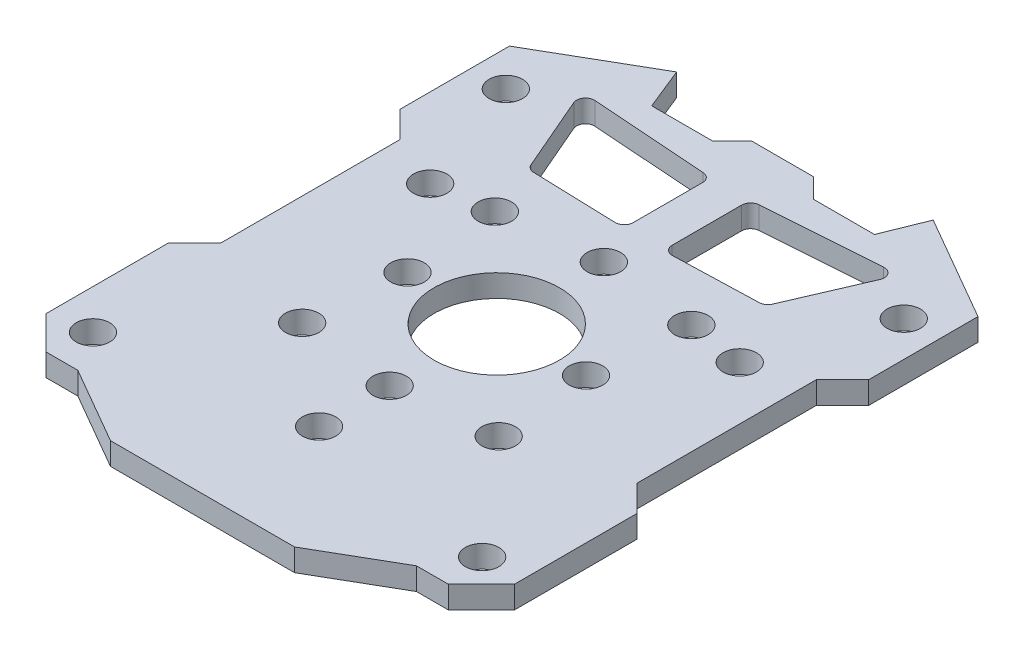
from build123d import *

# Parameters (mm, degrees)
BOSS_EXTRUDE1_DEPTH = 2
SKETCH2_R           = 1.5
SKETCH2_R_2         = 5.625
CUT_EXTRUDE1_DEPTH  = 2
CUT_EXTRUDE2_DEPTH  = 2


with BuildPart() as part:
    # Sketch1 → Boss-Extrude1 (new body)
    with BuildSketch(Plane(origin=(0, 0, 0), x_dir=(1, 0, 0), z_dir=(0, 1, 0))):
        Polygon((2.75, 52), (-2.75, 52), (-4.5, 50.25), (-9.984901653, 50.25), (-11.5, 54), (-21, 48.515172443), (-21, 38.719848481), (-18.65, 36.369848481), (-18.65, 20.319848481), (-21, 17.969848481), (-21, 6.969848481), (-18.030151519, 4), (-15.17820323, 4), (-8.25, 0), (8.25, 0), (15.17820323, 4), (18.030151519, 4), (21, 6.969848481), (21, 17.969848481), (18.65, 20.319848481), (18.65, 36.369848481), (21, 38.719848481), (21, 48.515172443), (11.5, 54), (9.984901653, 50.25), (4.5, 50.25), align=None)
    extrude(amount=BOSS_EXTRUDE1_DEPTH)

    # Sketch2 → Cut-Extrude1 (cut)
    with BuildSketch(Plane(origin=(0, 2, 0), x_dir=(1, 0, 0), z_dir=(0, 1, 0))):
        with Locations(Location((-17.835663744, 45.024259573, 0), (0, 0, 270))):
            Circle(SKETCH2_R)
        with Locations(Location((-17.442435228, 7.623278695, 0), (0, 0, 270))):
            Circle(SKETCH2_R)
        with Locations(Location((0, 10.45, 0), (0, 0, 270))):
            Circle(SKETCH2_R)
        with Locations(Location((0, 16.775, 0), (0, 0, 270))):
            Circle(SKETCH2_R)
        with Locations(Location((0, 26.375, 0), (0, 0, 270))):
            Circle(SKETCH2_R_2)
        with Locations(Location((-8.807408648, 17.738925781, 0), (0, 0, 270))):
            Circle(SKETCH2_R)
        with Locations(Location((-8, 26.375, 0), (0, 0, 270))):
            Circle(SKETCH2_R)
        with Locations(Location((-13.875097841, 34.281056246, 0), (0, 0, 270))):
            Circle(SKETCH2_R)
        with Locations(Location((-8.807408648, 35.011074219, 0), (0, 0, 270))):
            Circle(SKETCH2_R)
        with Locations(Location((0, 35.975, 0), (0, 0, 270))):
            Circle(SKETCH2_R)
    cut_extrude1 = extrude(amount=-CUT_EXTRUDE1_DEPTH, mode=Mode.SUBTRACT)

    # Mirror1: Cut-Extrude1 across plane
    add(cut_extrude1.mirror(Plane(origin=(0, 0, 0), x_dir=(0, 0, 1), z_dir=(1, 0, 0))), mode=Mode.SUBTRACT)

    # Sketch3 → Cut-Extrude2 (cut)
    with BuildSketch(Plane(origin=(0, 2, 0), x_dir=(1, 0, 0), z_dir=(0, 1, 0))):
        with BuildLine():
            Line((-2.493142416, 47.37764179), (-12.937365744, 48.121815295))
            ThreePointArc((-12.937365744, 48.121815295), (-13.646553366, 47.786942566), (-13.728804091, 47.006992794))
            Line((-13.728804091, 47.006992794), (-10.826295121, 40.277760665))
            ThreePointArc((-10.826295121, 40.277760665), (-10.541841622, 39.933254988), (-10.117006121, 39.795006111))
            Line((-10.117006121, 39.795006111), (-2.575291763, 39.556457804))
            ThreePointArc((-2.575291763, 39.556457804), (-1.993328378, 39.781500074), (-1.75, 40.356057908))
            Line((-1.75, 40.356057908), (-1.75, 46.579664839))
            ThreePointArc((-1.75, 46.579664839), (-1.964557404, 47.12487761), (-2.493142416, 47.37764179))
        make_face()
        with BuildLine():
            Line((10.117006121, 39.795006111), (2.575291763, 39.556457804))
            ThreePointArc((2.575291763, 39.556457804), (1.993328378, 39.781500074), (1.75, 40.356057908))
            Line((1.75, 40.356057908), (1.75, 46.579664839))
            ThreePointArc((1.75, 46.579664839), (1.964557404, 47.12487761), (2.493142416, 47.37764179))
            Line((2.493142416, 47.37764179), (12.937365744, 48.121815295))
            ThreePointArc((12.937365744, 48.121815295), (13.646553366, 47.786942566), (13.728804091, 47.006992794))
            Line((13.728804091, 47.006992794), (10.826295121, 40.277760665))
            ThreePointArc((10.826295121, 40.277760665), (10.541841622, 39.933254988), (10.117006121, 39.795006111))
        make_face()
    extrude(amount=-CUT_EXTRUDE2_DEPTH, mode=Mode.SUBTRACT)


solid = part.part
